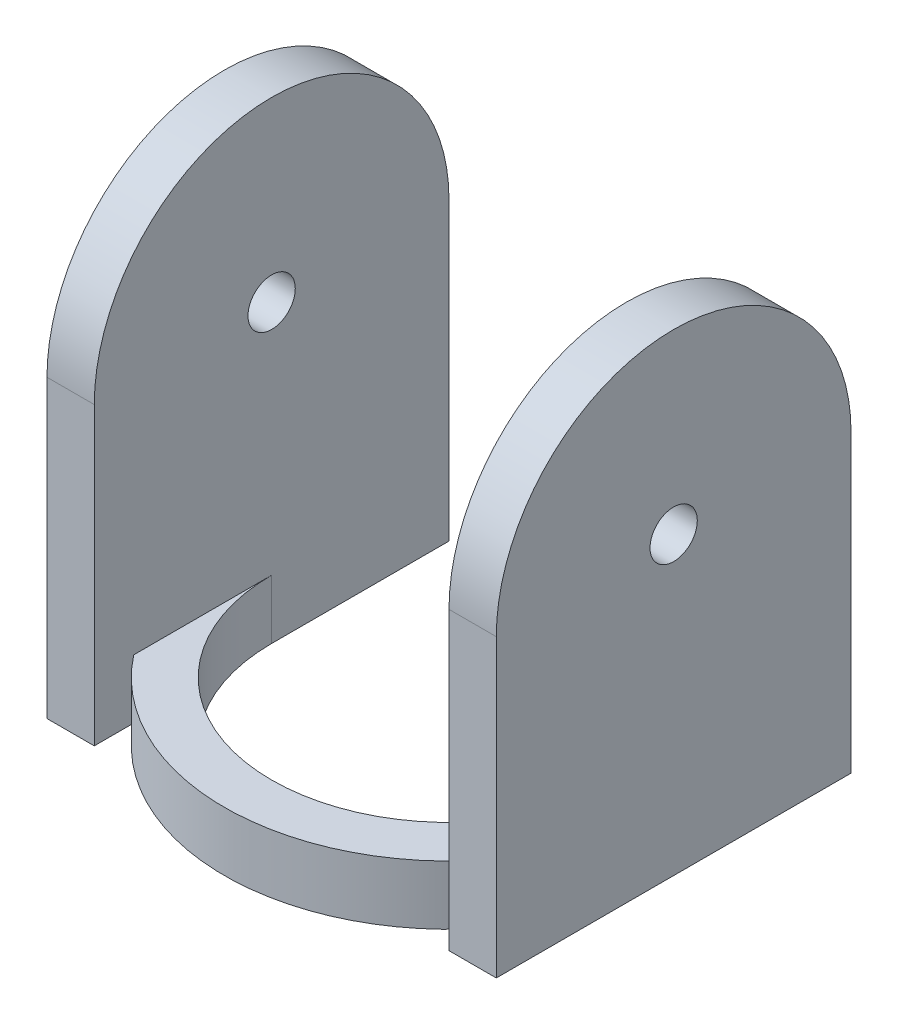
from build123d import *

# Parameters (mm, degrees)
SKETCH_1_R          = 38
SKETCH_1_R_2        = 30
EXTRUDE_1_DEPTH     = 10
SKETCH_2_W          = 8
SKETCH_2_H          = 60
EXTRUDE_2_DEPTH     = 80
SKETCH_3_R          = 4
CUT_EXTRUDE_1_DEPTH = 80
SKETCH_4_W          = 60
SKETCH_4_H          = 40.678120155
CUT_EXTRUDE_2_DEPTH = 97.374270425


with BuildPart() as part:
    # 草图1 → 凸台-拉伸1 (new body)
    with BuildSketch(Plane(origin=(0, 0, 0), x_dir=(1, 0, 0), z_dir=(0, 1, 0))):
        with Locations(Location((0, 0, 0), (0, 0, 270))):
            Circle(SKETCH_1_R)
        with Locations(Location((0, 0, 0), (0, 0, 270))):
            Circle(SKETCH_1_R_2, mode=Mode.SUBTRACT)
    extrude(amount=EXTRUDE_1_DEPTH)

    # 草图2 → 凸台-拉伸2 (add)
    with BuildSketch(Plane.XZ):
        with Locations((-34, 0)):
            Rectangle(SKETCH_2_W, SKETCH_2_H)
        with Locations((34, 0)):
            Rectangle(SKETCH_2_W, SKETCH_2_H)
    extrude(amount=-EXTRUDE_2_DEPTH)

    # 草图3 → 切除-拉伸1 (cut)
    with BuildSketch(Plane(origin=(38, 0, 0), x_dir=(0, 0, -1), z_dir=(1, 0, 0))):
        with Locations((0, 50)):
            Circle(SKETCH_3_R)
        with BuildLine():
            Line((-30, 50), (-30, 88))
            Line((-30, 88), (30, 88))
            Line((30, 88), (30, 50))
            ThreePointArc((30, 50), (0, 80), (-30, 50))
        make_face()
    extrude(amount=-CUT_EXTRUDE_1_DEPTH, mode=Mode.SUBTRACT)

    # 草图4 → 切除-拉伸2 (cut, through all)
    with BuildSketch(Plane.XZ):
        with Locations((0, -20.339060078)):
            Rectangle(SKETCH_4_W, SKETCH_4_H)
    extrude(amount=-CUT_EXTRUDE_2_DEPTH, mode=Mode.SUBTRACT)


solid = part.part
